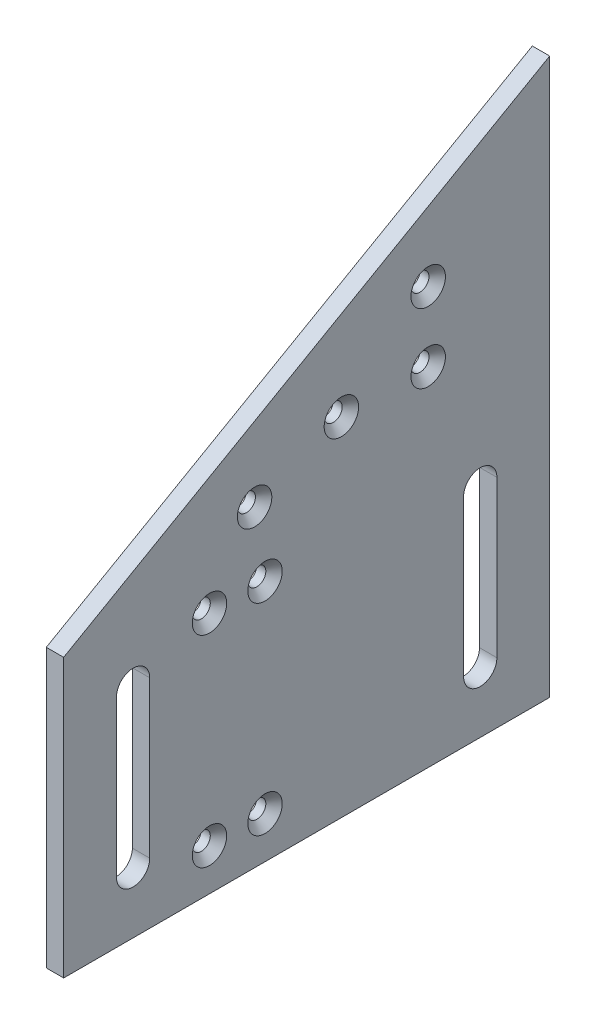
from build123d import *

# Parameters (mm, degrees)
BOSS_EXTRUDE1_DEPTH                             = 6.35
CSK_FOR_M6_FLAT_HEAD_MACHINE_SCREW1_D           = 6.6
CSK_FOR_M6_FLAT_HEAD_MACHINE_SCREW1_CSINK_D     = 12.6
CSK_FOR_M6_FLAT_HEAD_MACHINE_SCREW1_CSINK_ANGLE = 90
CSK_FOR_M6_FLAT_HEAD_MACHINE_SCREW2_D           = 6.6
CSK_FOR_M6_FLAT_HEAD_MACHINE_SCREW2_CSINK_D     = 12.6
CSK_FOR_M6_FLAT_HEAD_MACHINE_SCREW2_CSINK_ANGLE = 90


with BuildPart() as part:
    # Sketch2 → Boss-Extrude1 (new body)
    # profile 1 of 3: a face of its own
    with BuildSketch(Plane(origin=(0, 0, 0), x_dir=(0, 0, -1), z_dir=(1, 0, 0))):
        Polygon((-134.915615546, 101.6), (-134.915615546, 0), (-46.015615546, 0), (-46.015615546, 50.8), (-46.015615546, 101.6), align=None)
        with BuildLine():
            Line((-103.431783211, 79.375), (-103.431783211, 50.8))
            Line((-103.431783211, 50.8), (-103.431783211, 22.225))
            ThreePointArc((-103.431783211, 22.225), (-109.515615546, 16.141167665), (-115.599447882, 22.225))
            Line((-115.599447882, 22.225), (-115.599447882, 79.375))
            ThreePointArc((-115.599447882, 79.375), (-109.515615546, 85.458832335), (-103.431783211, 79.375))
        make_face(mode=Mode.SUBTRACT)
    # profile 2 of 3: a face of its own
    with BuildSketch(Plane(origin=(0, 0, 0), x_dir=(0, 0, -1), z_dir=(1, 0, 0))):
        Polygon((42.884384454, 203.2), (-134.915615546, 101.6), (-46.015615546, 101.6), (42.884384454, 101.6), align=None)
    # profile 3 of 3: a face of its own
    with BuildSketch(Plane(origin=(0, 0, 0), x_dir=(0, 0, -1), z_dir=(1, 0, 0))):
        Polygon((-46.015615546, 50.8), (-46.015615546, 0), (42.884384454, 0), (42.884384454, 101.6), (-46.015615546, 101.6), align=None)
        with BuildLine():
            Line((11.400552118, 22.225), (11.400552118, 50.8))
            Line((11.400552118, 50.8), (11.400552118, 79.375))
            ThreePointArc((11.400552118, 79.375), (17.484384454, 85.458832335), (23.568216789, 79.375))
            Line((23.568216789, 79.375), (23.568216789, 22.225))
            ThreePointArc((23.568216789, 22.225), (17.484384454, 16.141167665), (11.400552118, 22.225))
        make_face(mode=Mode.SUBTRACT)
    extrude(amount=BOSS_EXTRUDE1_DEPTH)

    # CSK for M6 Flat Head Machine Screw1 (through all)
    with Locations(Plane(origin=(6.35, 0, 0), x_dir=(0, 0, -1), z_dir=(1, 0, 0))):
        with Locations((-81.575615546, 15.24), (-81.575615546, 88.9), (-61.255615546, 88.9), (-61.255615546, 15.24)):
            CounterSinkHole(CSK_FOR_M6_FLAT_HEAD_MACHINE_SCREW1_D / 2, CSK_FOR_M6_FLAT_HEAD_MACHINE_SCREW1_CSINK_D / 2, counter_sink_angle=CSK_FOR_M6_FLAT_HEAD_MACHINE_SCREW1_CSINK_ANGLE)

    # CSK for M6 Flat Head Machine Screw2 (through all)
    with Locations(Plane(origin=(6.35, 0, 0), x_dir=(0, 0, -1), z_dir=(1, 0, 0))):
        with Locations((-65.065615546, 114.3), (-33.315615546, 127), (-1.565615546, 127), (-1.565615546, 152.4)):
            CounterSinkHole(CSK_FOR_M6_FLAT_HEAD_MACHINE_SCREW2_D / 2, CSK_FOR_M6_FLAT_HEAD_MACHINE_SCREW2_CSINK_D / 2, counter_sink_angle=CSK_FOR_M6_FLAT_HEAD_MACHINE_SCREW2_CSINK_ANGLE)


solid = part.part
